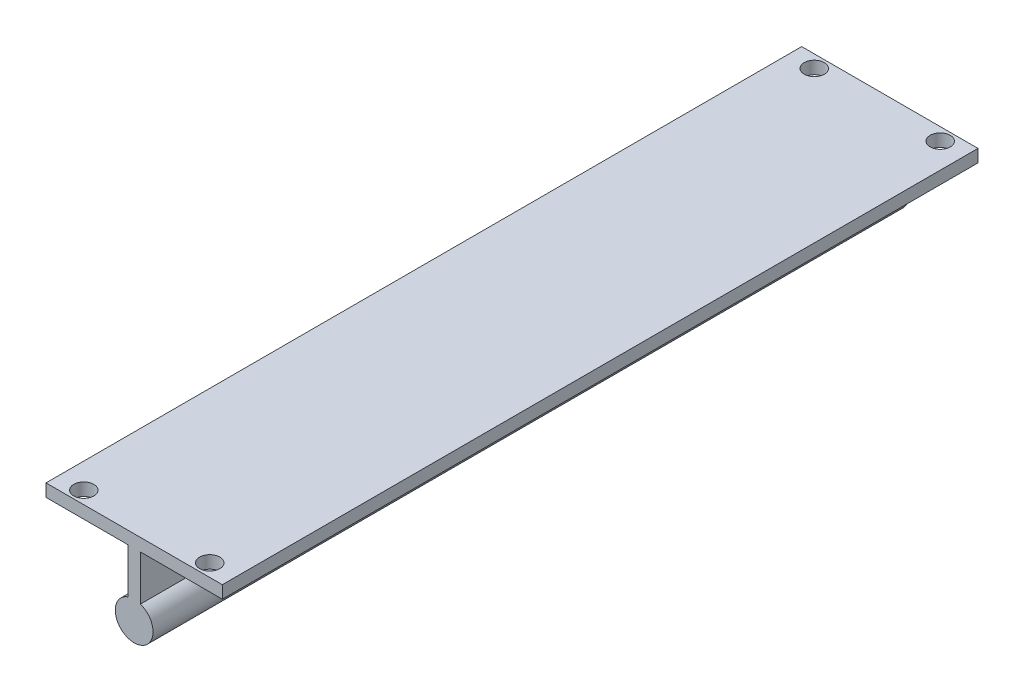
from build123d import *

# Parameters (mm, degrees)
SKETCH1_R               = 7.5
BOSS_EXTRUDE1_DEPTH     = 300
SKETCH3_W               = 5
SKETCH3_H               = 30
BOSS_EXTRUDE2_DEPTH     = 300
SKETCH4_W               = 70
SKETCH4_H               = 5
BOSS_EXTRUDE3_DEPTH     = 300
CUT_EXTRUDE1_DEPTH      = 305.353823699
CUT_EXTRUDE1_DEPTH_BACK = 305.353823699
SKETCH6_R               = 4


with BuildPart() as part:
    # Sketch1 → Boss-Extrude1 (new body)
    with BuildSketch(Plane.XY):
        Circle(SKETCH1_R)
    extrude(amount=BOSS_EXTRUDE1_DEPTH)

    # Sketch3 → Boss-Extrude2 (add)
    with BuildSketch(Plane.XY.offset(300)):
        with Locations((0, 15)):
            Rectangle(SKETCH3_W, SKETCH3_H)
    extrude(amount=-BOSS_EXTRUDE2_DEPTH)

    # Sketch4 → Boss-Extrude3 (add)
    with BuildSketch(Plane.XY.offset(300)):
        with Locations((0, 27.5)):
            Rectangle(SKETCH4_W, SKETCH4_H)
    extrude(amount=-BOSS_EXTRUDE3_DEPTH)

    # Sketch6 → Cut-Extrude1 (cut, two sides: drawn at the far end of the back side and taken through both)
    with BuildSketch(Plane(origin=(0, 30, 0), x_dir=(1, 0, 0), z_dir=(0, 1, 0)).offset(-CUT_EXTRUDE1_DEPTH_BACK)):
        with Locations(Location((-25, -5, 0), (0, 0, 270))):
            Circle(SKETCH6_R)
        with Locations(Location((25, -5, 0), (0, 0, 270))):
            Circle(SKETCH6_R)
        with Locations(Location((25, -295, 0), (0, 0, 270))):
            Circle(SKETCH6_R)
        with Locations(Location((-25, -295, 0), (0, 0, 270))):
            Circle(SKETCH6_R)
    extrude(amount=CUT_EXTRUDE1_DEPTH + CUT_EXTRUDE1_DEPTH_BACK, mode=Mode.SUBTRACT)


solid = part.part
